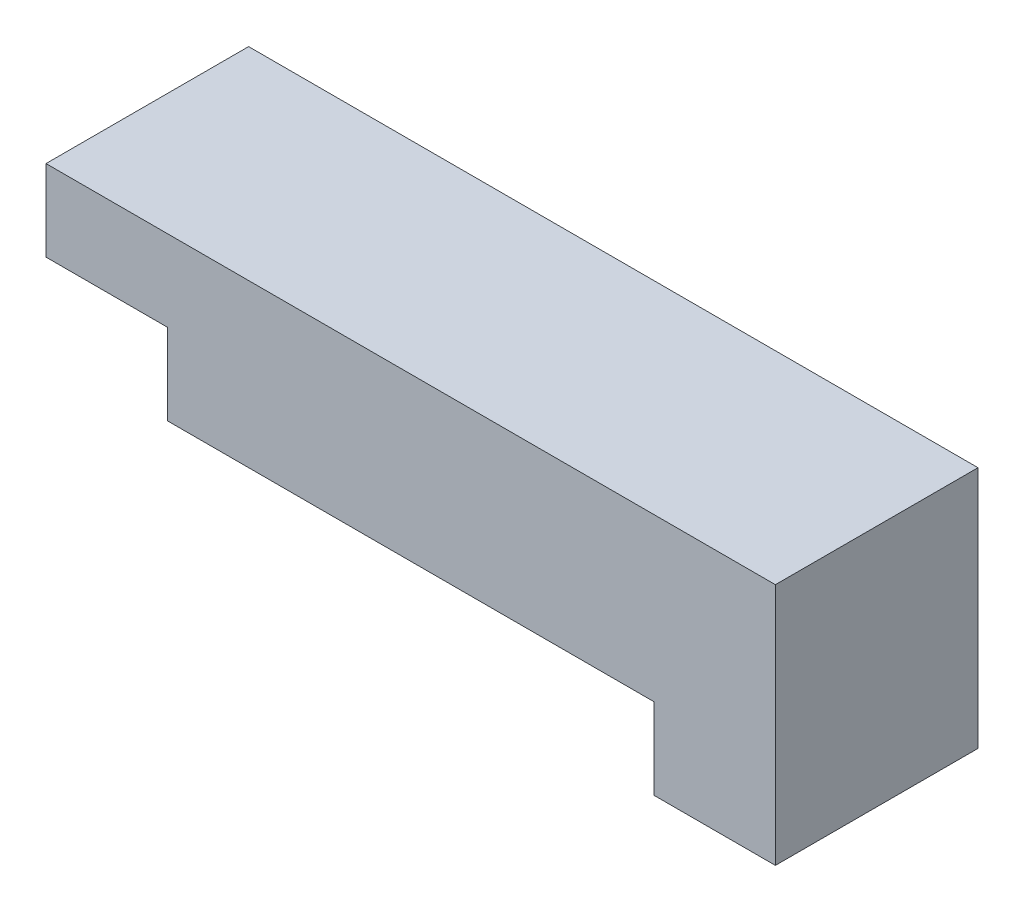
from build123d import *

# Parameters (mm, degrees)
SKETCH2_W           = 18
SKETCH2_H           = 5
BOSS_EXTRUDE1_DEPTH = 6
CUT_EXTRUDE1_DEPTH  = 15
CUT_EXTRUDE2_REACH  = 13.916
SKETCH4_W           = 3
SKETCH4_H           = 2


with BuildPart() as part:
    # Sketch2 → Boss-Extrude1 (new body)
    with BuildSketch(Plane(origin=(0, 0, 0), x_dir=(1, 0, 0), z_dir=(0, 1, 0))):
        Rectangle(SKETCH2_W, SKETCH2_H)
    extrude(amount=BOSS_EXTRUDE1_DEPTH)

    # Sketch3 → Cut-Extrude1 (cut)
    with BuildSketch(Plane(origin=(-9, 0, 0), x_dir=(0, 0, -1), z_dir=(1, 0, 0))):
        Polygon((-2.5, 0), (1.5, 0), (1.5, 4), (-0.6, 4), (-0.6, 2), (-2.5, 2), align=None)
    extrude(amount=CUT_EXTRUDE1_DEPTH, mode=Mode.SUBTRACT)

    # Sketch4 → Cut-Extrude2 (cut, up to next)
    with BuildSketch(Plane.XY.offset(2.5), mode=Mode.PRIVATE) as cut_extrude2_sk1:
        with Locations((-7.5, 3)):
            Rectangle(SKETCH4_W, SKETCH4_H)
    cut_extrude2_tool1 = extrude(cut_extrude2_sk1.sketch, amount=-CUT_EXTRUDE2_REACH, mode=Mode.PRIVATE) & part.part
    add(cut_extrude2_tool1.solids().sort_by_distance((-7.5, 3, 2.5))[0], mode=Mode.SUBTRACT)


solid = part.part
